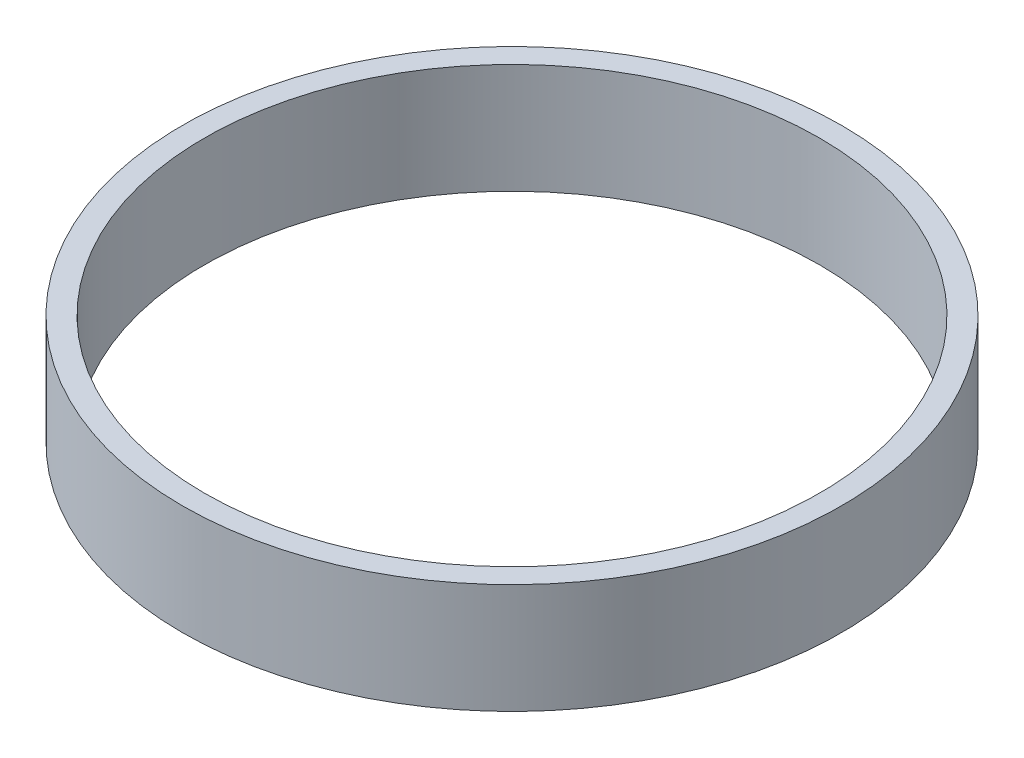
from build123d import *

# Parameters (mm, degrees)
SKETCH1_R           = 30
SKETCH1_R_2         = 28
BOSS_EXTRUDE1_DEPTH = 10


with BuildPart() as part:
    # Sketch1 → Boss-Extrude1 (new body)
    with BuildSketch(Plane(origin=(0, 0, 0), x_dir=(1, 0, 0), z_dir=(0, 1, 0))):
        with Locations(Location((0, 0, 0), (0, 0, 270))):
            Circle(SKETCH1_R)
        with Locations(Location((0, 0, 0), (0, 0, 270))):
            Circle(SKETCH1_R_2, mode=Mode.SUBTRACT)
    extrude(amount=BOSS_EXTRUDE1_DEPTH)


solid = part.part
